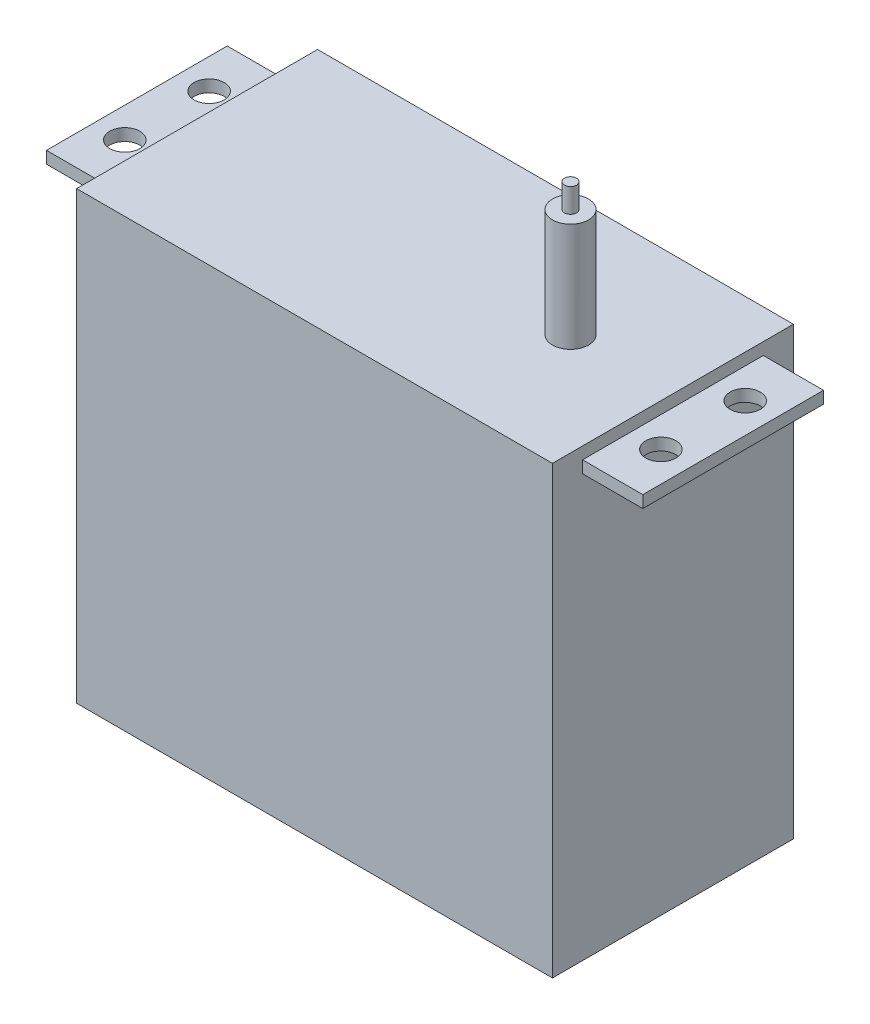
from build123d import *

# Parameters (mm, degrees)
SKETCH_1_W      = 39.5
SKETCH_1_H      = 20
EXTRUDE_1_DEPTH = 37
SKETCH_2_R      = 1.5
EXTRUDE_2_DEPTH = 9
SKETCH_14_W     = 15
SKETCH_14_H     = 1
EXTRUDE_5_DEPTH = 5
SKETCH_15_W     = 15
SKETCH_15_H     = 1
EXTRUDE_6_DEPTH = 5
M3X0_5_1_D      = 2.5
M3X0_5_1_DEPTH  = 8.5
M3X0_5_1_TIP    = 0.751075774
SKETCH_3_R      = 0.5
EXTRUDE_7_DEPTH = 2


with BuildPart() as part:
    # ｽｹｯﾁ1 → ﾎﾞｽ - 押し出し1 (new body)
    with BuildSketch(Plane(origin=(0, 0, 0), x_dir=(1, 0, 0), z_dir=(0, 1, 0))):
        with Locations((19.75, 10)):
            Rectangle(SKETCH_1_W, SKETCH_1_H)
    extrude(amount=EXTRUDE_1_DEPTH)

    # ｽｹｯﾁ2 → ﾎﾞｽ - 押し出し2 (add)
    with BuildSketch(Plane(origin=(0, 37, 0), x_dir=(1, 0, 0), z_dir=(0, 1, 0))):
        with Locations(Location((31, 10, 0), (0, 0, 90))):
            Circle(SKETCH_2_R)
    extrude(amount=EXTRUDE_2_DEPTH)

    # ｽｹｯﾁ14 → ﾎﾞｽ - 押し出し5 (add)
    with BuildSketch(Plane(origin=(39.5, 0, 0), x_dir=(0, 0, -1), z_dir=(1, 0, 0))):
        with Locations((10, 35.5)):
            Rectangle(SKETCH_14_W, SKETCH_14_H)
    extrude(amount=EXTRUDE_5_DEPTH)

    # ｽｹｯﾁ15 → ﾎﾞｽ - 押し出し6 (add)
    with BuildSketch(Plane.ZY):
        with Locations((-10, 35.5)):
            Rectangle(SKETCH_15_W, SKETCH_15_H)
    extrude(amount=EXTRUDE_6_DEPTH)

    # M3x0.5 ねじ穴1
    with Locations(Plane(origin=(0, 36, 0), x_dir=(1, 0, 0), z_dir=(0, 1, 0))):
        with Locations((-2.5, 13.5), (-2.5, 6.5), (42, 6.5), (42, 13.5)):
            Hole(M3X0_5_1_D / 2, depth=M3X0_5_1_DEPTH)
            with Locations((0, 0, -(M3X0_5_1_DEPTH + M3X0_5_1_TIP / 2))):  # 118° drill point
                Cone(0, M3X0_5_1_D / 2, M3X0_5_1_TIP, mode=Mode.SUBTRACT)

    # ｽｹｯﾁ3 → ﾎﾞｽ - 押し出し7 (add)
    with BuildSketch(Plane(origin=(0, 46, 0), x_dir=(1, 0, 0), z_dir=(0, 1, 0))):
        with Locations(Location((31, 10, 0), (0, 0, 270))):
            Circle(SKETCH_3_R)
    extrude(amount=EXTRUDE_7_DEPTH)


solid = part.part
